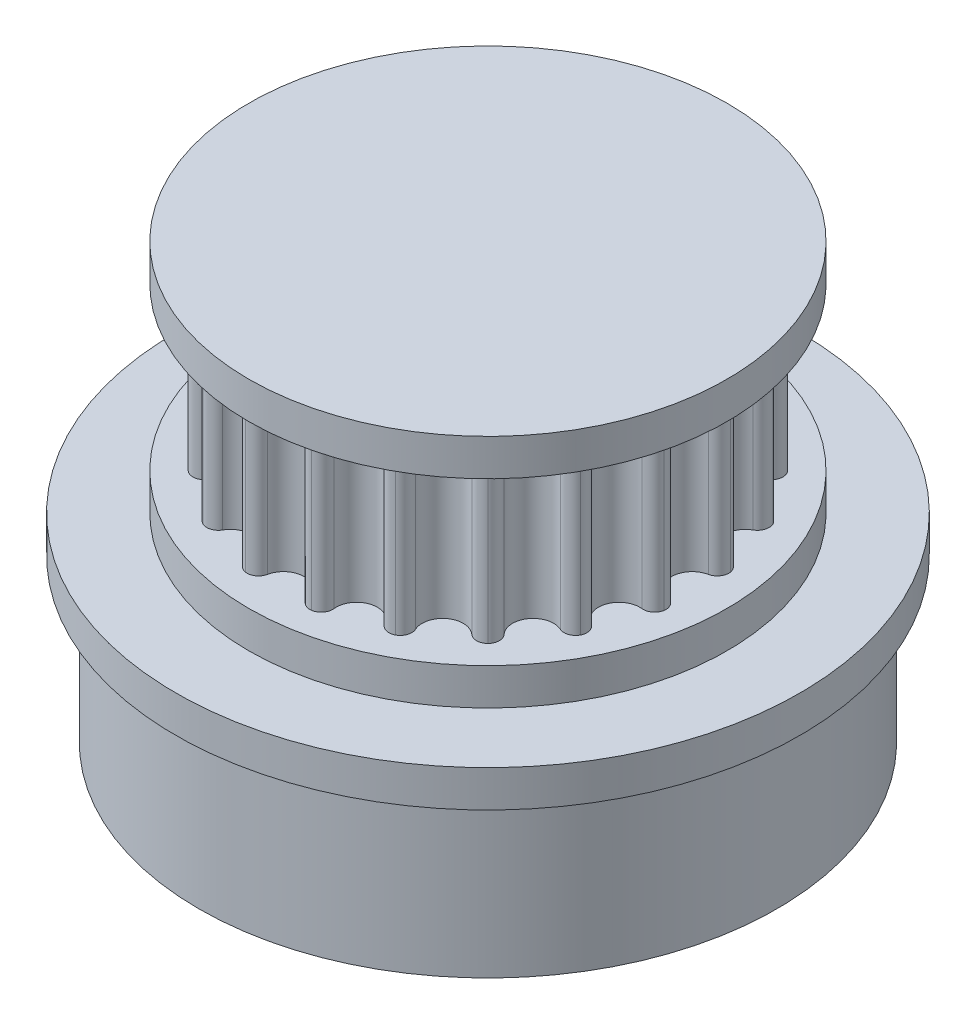
from build123d import *

# Parameters (mm, degrees)
BOSS_EXTRUDE1_DEPTH = 3.499999985
CIRPATTERN1_COUNT   = 20
SKETCH2_W           = 10.342329408
SKETCH2_H           = 1.5875


with BuildPart() as part:
    # Sketch1 → Boss-Extrude1 (new, symmetric)
    with BuildSketch(Plane(origin=(0, 0, 0), x_dir=(1, 0, 0), z_dir=(0, 1, 0))):
        with BuildLine():
            ThreePointArc((0.872060607, 8.659786465), (0.562967303, 8.148255135), (0, 7.947579308))
            ThreePointArc((0, 7.947579308), (-1.243275317, -7.849731418), (2.45593707, 7.55859709))
            ThreePointArc((2.45593707, 7.55859709), (1.982535589, 7.923417607), (1.846642263, 8.505427895))
            ThreePointArc((1.846642263, 8.505427895), (1.749626992, 8.862101959), (1.434119122, 9.054671776))
            ThreePointArc((1.434119122, 9.054671776), (1.074545959, 8.969024291), (0.872060607, 8.659786465))
        make_face()
    boss_extrude1 = extrude(amount=BOSS_EXTRUDE1_DEPTH, both=True)

    # CirPattern1: Boss-Extrude1 ×20 about axis
    cirpattern1_axis = Axis((0, 0, 0), (0, 1, 0))
    for i in range(1, CIRPATTERN1_COUNT):
        add(boss_extrude1.rotate(cirpattern1_axis, i * 360 / CIRPATTERN1_COUNT))

    # Sketch2 → Revolve3 (revolve)
    with BuildSketch(Plane(origin=(0, 0, 0), x_dir=(0, 0, -1), z_dir=(1, 0, 0)), mode=Mode.PRIVATE) as revolve3_sk:
        with Locations((5.171164704, 4.293749985)):
            Rectangle(SKETCH2_W, SKETCH2_H)
    revolve3 = revolve(revolve3_sk.sketch.rotate(Axis((0, 3.3, 0), (0, -1, 0)), 180), axis=Axis((0, 3.3, 0), (0, -1, 0)))

    # Mirror1: Revolve3 across plane
    add(revolve3.mirror(Plane.ZX))

    # Sketch5 → Revolve4 (revolve)
    with BuildSketch(Plane.XY, mode=Mode.PRIVATE) as revolve4_sk:
        Polygon((0, -5.087499985), (13.500000032, -5.087499985), (13.500000032, -6.674999985), (12.5, -6.674999985), (12.5, -13.674999955), (0, -13.674999955), align=None)
    revolve(revolve4_sk.sketch.rotate(Axis((0, -13.674999955, 0), (0, 1, 0)), 90), axis=Axis((0, -13.674999955, 0), (0, 1, 0)))


solid = part.part
